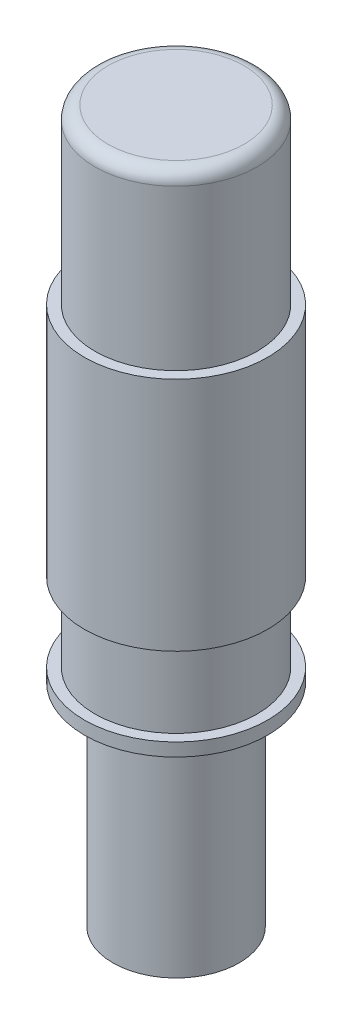
from build123d import *

# Parameters (mm, degrees)
SKETCH1_R           = 3.5
BOSS_EXTRUDE1_DEPTH = 0.5
SKETCH2_R           = 3.1
BOSS_EXTRUDE2_DEPTH = 3
SKETCH3_R           = 3.5
BOSS_EXTRUDE3_DEPTH = 9
SKETCH4_R           = 3.1
BOSS_EXTRUDE4_DEPTH = 6.6
FILLET1_R           = 0.5
BOSS_EXTRUDE5_DEPTH = 8.0772


with BuildPart() as part:
    # Sketch1 → Boss-Extrude1 (new body)
    with BuildSketch(Plane(origin=(0, 0, 0), x_dir=(1, 0, 0), z_dir=(0, 1, 0))):
        with Locations(Location((0, 0, 0), (0, 0, 270))):
            Circle(SKETCH1_R)
    extrude(amount=BOSS_EXTRUDE1_DEPTH)

    # Sketch2 → Boss-Extrude2 (add)
    with BuildSketch(Plane(origin=(0, 0.5, 0), x_dir=(1, 0, 0), z_dir=(0, 1, 0))):
        with Locations(Location((0, 0, 0), (0, 0, 270))):
            Circle(SKETCH2_R)
    extrude(amount=BOSS_EXTRUDE2_DEPTH)

    # Sketch3 → Boss-Extrude3 (add)
    with BuildSketch(Plane(origin=(0, 3.5, 0), x_dir=(1, 0, 0), z_dir=(0, 1, 0))):
        with Locations(Location((0, 0, 0), (0, 0, 270))):
            Circle(SKETCH3_R)
    extrude(amount=BOSS_EXTRUDE3_DEPTH)

    # Sketch4 → Boss-Extrude4 (add)
    with BuildSketch(Plane(origin=(0, 12.5, 0), x_dir=(1, 0, 0), z_dir=(0, 1, 0))):
        with Locations(Location((0, 0, 0), (0, 0, 270))):
            Circle(SKETCH4_R)
    extrude(amount=BOSS_EXTRUDE4_DEPTH)

    # Fillet1
    fillet1_edges = [part.edges().sort_by_distance(p)[0] for p in [
        (0, 19.1, -3.1),
    ]]
    fillet(fillet1_edges, radius=FILLET1_R)

    # Sketch5 → Boss-Extrude5 (add)
    with BuildSketch(Plane.XZ):
        with BuildLine():
            ThreePointArc((2.413, 0), (-1.060369493, 2.167529824), (-1.481061781, -1.905))
            Line((-1.481061781, -1.905), (1.481061781, -1.905))
            ThreePointArc((1.481061781, -1.905), (2.167529824, -1.060369493), (2.413, 0))
        make_face()
    extrude(amount=BOSS_EXTRUDE5_DEPTH)


solid = part.part
